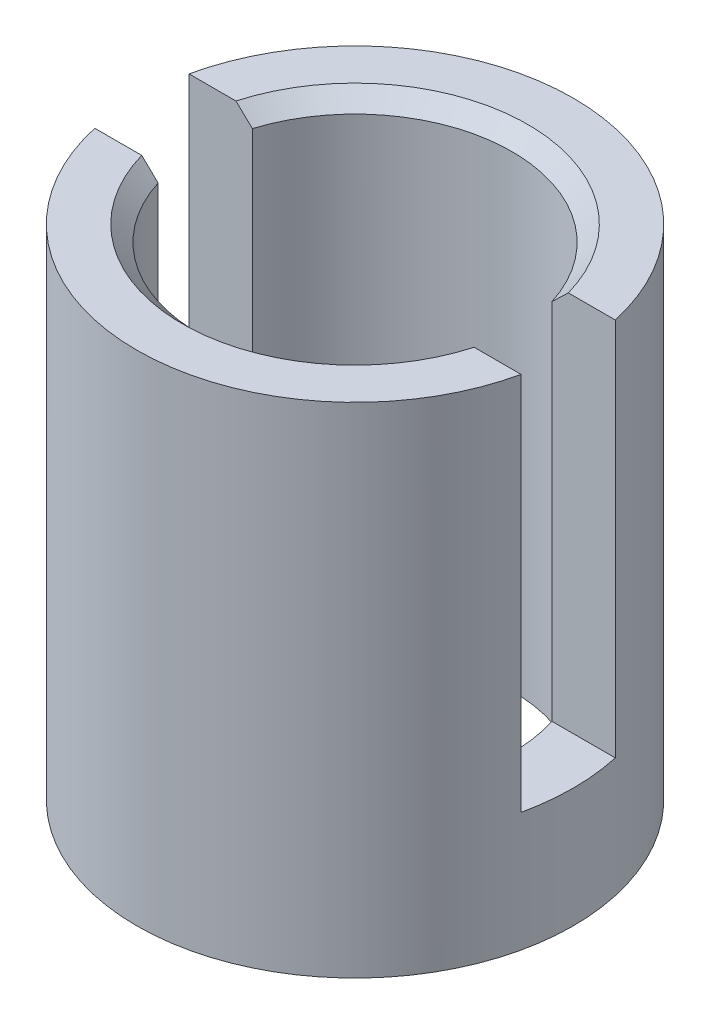
from build123d import *

# Parameters (mm, degrees)
SKETCH_1_R          = 2.78
SKETCH_1_R_2        = 2
EXTRUDE_1_DEPTH     = 6.35
CUT_EXTRUDE_START   = -4.83
CUT_EXTRUDE_1_DEPTH = 4.83
CHAMFER_1_SIZE      = 0.2


with BuildPart() as part:
    # 草图1 → 凸台-拉伸1 (new body)
    with BuildSketch(Plane(origin=(0, 0, 0), x_dir=(1, 0, 0), z_dir=(0, 1, 0))):
        with Locations(Location((0, 0, 0), (0, 0, 270))):
            Circle(SKETCH_1_R)
        with Locations(Location((0, 0, 0), (0, 0, 270))):
            Circle(SKETCH_1_R_2, mode=Mode.SUBTRACT)
    extrude(amount=EXTRUDE_1_DEPTH)

    # 草图2 → 切除-拉伸1 (cut)
    with BuildSketch(Plane(origin=(0, 6.35, 0), x_dir=(1, 0, 0), z_dir=(0, 1, 0)).offset(CUT_EXTRUDE_START)):
        with BuildLine():
            Line((-2.714479692, 0.6), (2.714479692, 0.6))
            ThreePointArc((2.714479692, 0.6), (2.78, 0), (2.714479692, -0.6))
            Line((2.714479692, -0.6), (-2.714479692, -0.6))
            ThreePointArc((-2.714479692, -0.6), (-2.78, 0), (-2.714479692, 0.6))
        make_face()
    extrude(amount=CUT_EXTRUDE_1_DEPTH, mode=Mode.SUBTRACT)

    # 倒角1
    chamfer_1_edges = [part.edges().sort_by_distance(p)[0] for p in [
        (-1.183215957, 6.35, 1.61245155),
        (0, 0, -2),
        (0, 6.35, -2),
    ]]
    chamfer(chamfer_1_edges, length=CHAMFER_1_SIZE)


solid = part.part
